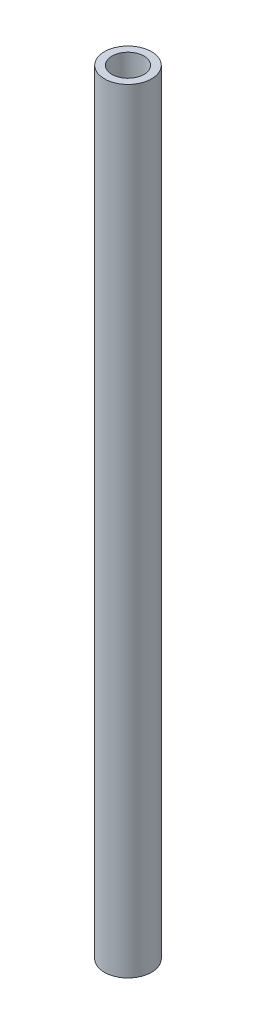
from build123d import *

# Parameters (mm, degrees)
SKETCH1_R           = 14
SKETCH1_R_2         = 9.5
BOSS_EXTRUDE1_DEPTH = 460


with BuildPart() as part:
    # Sketch1 → Boss-Extrude1 (new body)
    with BuildSketch(Plane(origin=(0, 0, 0), x_dir=(1, 0, 0), z_dir=(0, 1, 0))):
        with Locations(Location((0, 0, 0), (0, 0, 270))):
            Circle(SKETCH1_R)
        with Locations(Location((0, 0, 0), (0, 0, 270))):
            Circle(SKETCH1_R_2, mode=Mode.SUBTRACT)
    extrude(amount=BOSS_EXTRUDE1_DEPTH)


solid = part.part
